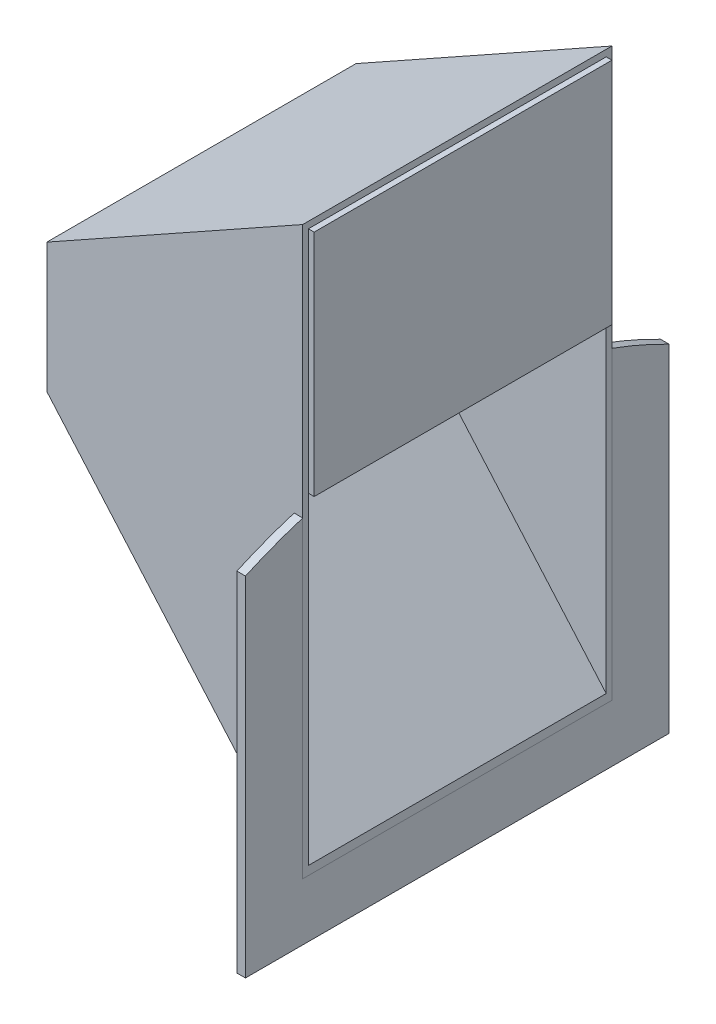
from build123d import *

# Parameters (mm, degrees)
BOSS_EXTRUDE1_DEPTH = 108
SHELL1_T            = -2
SKETCH5_W           = 104
SKETCH5_H           = 80
BOSS_EXTRUDE3_DEPTH = 2
BOSS_EXTRUDE9_DEPTH = 3


with BuildPart() as part:
    # Sketch1 → Boss-Extrude1 (new body)
    with BuildSketch(Plane.XY):
        Polygon((0, 214.471385382), (-89.379106021, 164.463309234), (-89.379106021, 119.263377535), (0, 16.555723533), align=None)
    extrude(amount=BOSS_EXTRUDE1_DEPTH)

    # Shell1
    shell1_openings = [part.faces().sort_by_distance(p)[0] for p in [
        (0, 115.513554458, 54),
    ]]
    offset(amount=SHELL1_T, openings=shell1_openings, kind=Kind.INTERSECTION)


with BuildPart() as body_2:
    # Sketch5 → Boss-Extrude3 (new body)
    with BuildSketch(Plane(origin=(0, 0, 0), x_dir=(0, 0, -1), z_dir=(1, 0, 0))):
        with Locations((-54, 172.179620919)):
            Rectangle(SKETCH5_W, SKETCH5_H)
    extrude(amount=BOSS_EXTRUDE3_DEPTH)


with BuildPart() as body_3:
    # Sketch6 → Boss-Extrude9 (new body)
    with BuildSketch(Plane(origin=(0, 0, 0), x_dir=(0, 0, -1), z_dir=(1, 0, 0))):
        with BuildLine():
            Line((0, 16.555723533), (-108, 16.555723533))
            Line((-108, 16.555723533), (-108, 125.706089257))
            ThreePointArc((-108, 125.706089257), (-118.11899718, 122.240119778), (-128, 118.144655013))
            Line((-128, 118.144655013), (-128, -3.444276467))
            Line((-128, -3.444276467), (20, -3.444276467))
            Line((20, -3.444276467), (20, 114.274981873))
            ThreePointArc((20, 114.274981873), (10.14060142, 118.97145575), (0, 123.025196008))
            Line((0, 123.025196008), (0, 16.555723533))
        make_face()
    extrude(amount=-BOSS_EXTRUDE9_DEPTH)


solid = Compound([part.part, body_2.part, body_3.part])
